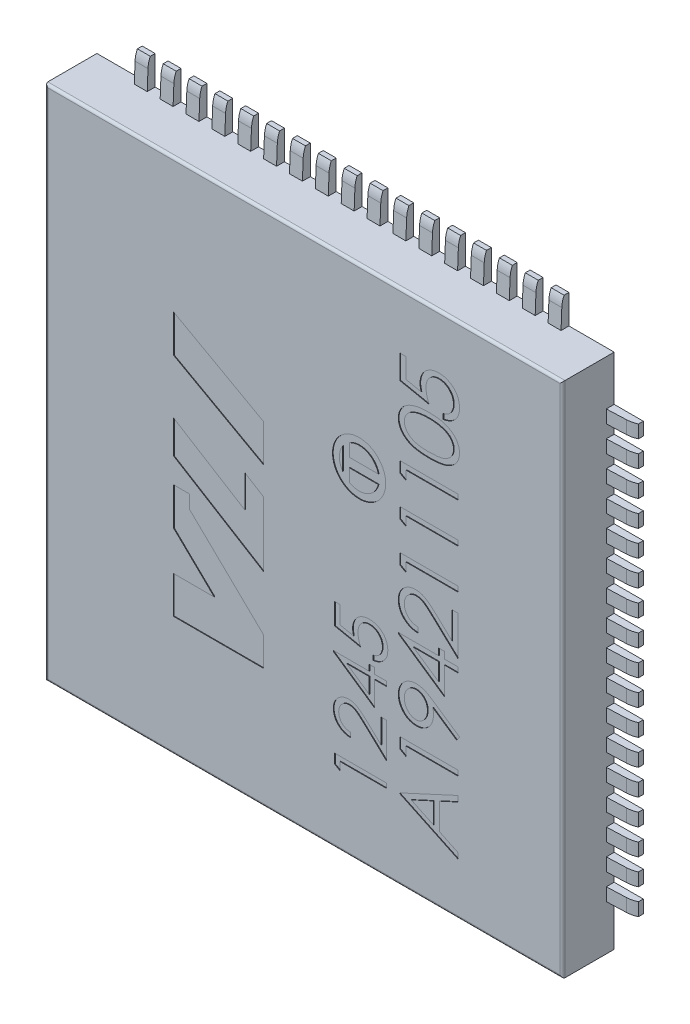
from build123d import *

# Parameters (mm, degrees)
SKETCH1_W                  = 8
SKETCH1_H                  = 8
BOSS_EXTRUDE1_DEPTH        = 0.8
FILLET1_R                  = 0.04
SKETCH3_W                  = 0.2
SKETCH3_H                  = 0.45
BOSS_EXTRUDE2_DEPTH        = 0.15
CUT_EXTRUDE2_DEPTH         = 9.586763069
LPATTERN1_COUNT            = 17
LPATTERN1_PITCH            = 0.4
SKETCH5_R                  = 2.5
BOSS_EXTRUDE3_DEPTH        = 0.1
CIRPATTERN1_COUNT          = 4
SZKIC1_R                   = 0.411647508
WYTNIJ_WYCI_GNI_CIE1_DEPTH = 0.01
WYTNIJ_WYCI_GNI_CIE2_DEPTH = 0.01


with BuildPart() as part:
    # Sketch1 → Boss-Extrude1 (new body)
    with BuildSketch(Plane.XY):
        Rectangle(SKETCH1_W, SKETCH1_H)
    extrude(amount=BOSS_EXTRUDE1_DEPTH)

    # Fillet1
    fillet1_edges = [part.edges().sort_by_distance(p)[0] for p in [
        (4, 0, 0.8),
        (0, 4, 0.8),
        (-4, 0, 0.8),
        (0, -4, 0.8),
    ]]
    fillet(fillet1_edges, radius=FILLET1_R)

    # Szkic1 → Wytnij-wyciągnięcie1 (cut)
    # profile 1 of 4: a face of its own
    with BuildSketch(Plane.XY.offset(0.8)):
        with Locations((0.855307319, 1.272637091)):
            Circle(SZKIC1_R)
        with BuildLine():
            Line((1.152633787, 1.201855815), (0.704434239, 1.201855815))
            Line((0.704434239, 1.201855815), (0.704434239, 1.006835791))
            ThreePointArc((0.704434239, 1.006835791), (0.977251368, 0.992382445), (1.152633787, 1.201855815))
        make_face(mode=Mode.SUBTRACT)
        with BuildLine():
            Line((1.152633787, 1.343418368), (0.704434239, 1.343418368))
            Line((0.704434239, 1.343418368), (0.704434239, 1.538438391))
            ThreePointArc((0.704434239, 1.538438391), (0.977251368, 1.552891737), (1.152633787, 1.343418368))
        make_face(mode=Mode.SUBTRACT)
        with BuildLine():
            Line((0.601420297, 1.102477174), (0.601420297, 1.442797008))
            ThreePointArc((0.601420297, 1.442797008), (0.549671887, 1.272637091), (0.601420297, 1.102477174))
        make_face(mode=Mode.SUBTRACT)
    # profile 2 of 4: a face of its own
    with BuildSketch(Plane.XY.offset(0.8)):
        Polygon((-2.01662611, -2.147052964), (-2.01662611, -1.573244018), (-1.38543627, -1.573244018), (-2.012111681, -0.967285149), (-2.012111681, -0.383894567), (-1.771453197, -0.383894567), (-1.771453197, -0.58733592), (-0.623213494, -1.697617287), (-0.623213494, -2.147052964), align=None)
    # profile 3 of 4: a face of its own
    with BuildSketch(Plane.XY.offset(0.8)):
        Polygon((-2.012111681, 0), (-2.012111681, 0.508995767), (-0.912436965, -0.170202966), (-0.912436965, 0.3284542), (-0.623213494, 0.149819362), (-0.623213494, -0.852189973), align=None)
    # profile 4 of 4: a face of its own
    with BuildSketch(Plane.XY.offset(0.8)):
        Polygon((-2.012111681, 1.348953622), (-2.012111681, 1.929165418), (-0.623213494, 1.158436315), (-0.623213494, 0.578224518), align=None)
    extrude(amount=-WYTNIJ_WYCI_GNI_CIE1_DEPTH, mode=Mode.SUBTRACT)

    # Szkic2 → Wytnij-wyciągnięcie2 (cut)
    # profile 1 of 14: a face of its own
    with BuildSketch(Plane.XY.offset(0.8)):
        Polygon((0.477972485, -2.880210932), (0.477972485, -2.732294265), (1.277972485, -2.732294265), (1.277972485, -2.804089137), (0.560023767, -2.804089137), (0.560023767, -2.92716606), align=None)
    # profile 2 of 14: a face of its own
    with BuildSketch(Plane.XY.offset(0.8)):
        with BuildLine():
            Line((0.724126331, -2.332294265), (0.724126331, -2.404089137))
            add(Edge.make_bspline(
                [(0.724126331, -2.404089137), (0.714601557, -2.403621216), (0.695895153, -2.402702232), (0.668621118, -2.398398623), (0.642551449, -2.392240709), (0.617895469, -2.38353409), (0.59443517, -2.372721227), (0.572263738, -2.359754364), (0.551465752, -2.344395769), (0.532234016, -2.326977087), (0.514591143, -2.308058541), (0.499355659, -2.287645755), (0.486483048, -2.266195463), (0.475721622, -2.243772743), (0.467643943, -2.220124614), (0.461650425, -2.195465675), (0.458044403, -2.169687587), (0.457656795, -2.152124153), (0.457459664, -2.143191701)],
                knots=[0, 0, 0, 0, 1.10065271, 2.161652631, 3.183658789, 4.190468796, 5.17591951, 6.163126047, 7.15150782, 8.156236427, 9.156009102, 10.134482811, 11.092018607, 12.041330605, 13.001268258, 13.972401359, 14.968799086, 16, 16, 16, 16], degree=3))
            add(Edge.make_bspline(
                [(0.457459664, -2.143191701), (0.457663359, -2.134418952), (0.458063613, -2.117180815), (0.461552566, -2.092032516), (0.466899077, -2.068035008), (0.474821763, -2.045460253), (0.484763001, -2.024076572), (0.497126234, -2.00414873), (0.511326474, -1.985194852), (0.528076353, -1.968145159), (0.545948516, -1.95248296), (0.565035836, -1.938983091), (0.584772713, -1.927356897), (0.60531332, -1.917841221), (0.626724548, -1.910627916), (0.648801119, -1.905283547), (0.671797813, -1.902228418), (0.687365474, -1.901762109), (0.695280177, -1.901525034)],
                knots=[0, 0, 0, 0, 1.111674182, 2.184400057, 3.212814286, 4.223731311, 5.211378316, 6.196328225, 7.191884489, 8.207283132, 9.220262353, 10.201199469, 11.166417575, 12.120932471, 13.06540007, 14.026332106, 14.996573967, 16, 16, 16, 16], degree=3))
            add(Edge.make_bspline(
                [(0.695280177, -1.901525034), (0.706422534, -1.901912072), (0.728511717, -1.902679355), (0.760972327, -1.909242552), (0.792421984, -1.919493522), (0.81773423, -1.931834682), (0.838128526, -1.944287974), (0.854928473, -1.955498974), (0.873012738, -1.968697944), (0.892454518, -1.983772116), (0.912999207, -2.00098109), (0.935065971, -2.019877779), (0.95824678, -2.040950195), (0.9740899, -2.055727025), (0.982299408, -2.063384009)],
                knots=[0, 0, 0, 0, 1.184416499, 2.348048165, 3.509039915, 4.696071444, 5.333504901, 6.05069495, 6.844171097, 7.714965912, 8.667477798, 9.695072654, 10.805644396, 12, 12, 12, 12], degree=3))
            Line((0.982299408, -2.063384009), (1.195921203, -2.263544265))
            Line((1.195921203, -2.263544265), (1.195921203, -1.891268624))
            Line((1.195921203, -1.891268624), (1.277972485, -1.891268624))
            Line((1.277972485, -1.891268624), (1.277972485, -2.434858368))
            Line((1.277972485, -2.434858368), (0.946882741, -2.124601957))
            add(Edge.make_bspline(
                [(0.946882741, -2.124601957), (0.938997414, -2.117048155), (0.923851314, -2.102538846), (0.901738638, -2.082017114), (0.881224457, -2.063585345), (0.862347531, -2.047124227), (0.844831745, -2.032990854), (0.829244384, -2.020448629), (0.814900509, -2.010399352), (0.798274083, -1.999492975), (0.777974125, -1.98892978), (0.753166425, -1.97985267), (0.727628767, -1.974317847), (0.710371159, -1.973653885), (0.701690434, -1.973319906)],
                knots=[0, 0, 0, 0, 1.329631726, 2.553950428, 3.673215718, 4.687767853, 5.603093632, 6.413772471, 7.123043292, 7.734684054, 8.834405432, 9.900288307, 10.943827018, 12, 12, 12, 12], degree=3))
            add(Edge.make_bspline(
                [(0.701690434, -1.973319906), (0.696231828, -1.973465219), (0.685473965, -1.973751602), (0.66970122, -1.976279075), (0.654486406, -1.98009862), (0.639782721, -1.985571821), (0.625738001, -1.992796219), (0.612335148, -2.001590135), (0.599377671, -2.011736435), (0.587228345, -2.023473868), (0.576101213, -2.036367929), (0.566244279, -2.049989472), (0.558006768, -2.064400925), (0.551253968, -2.079541524), (0.545956738, -2.09536906), (0.542286206, -2.111914144), (0.539981638, -2.129131062), (0.539669827, -2.14088729), (0.539510946, -2.146877598)],
                knots=[0, 0, 0, 0, 0.991446411, 1.95395049, 2.89581595, 3.838931463, 4.798493298, 5.75982156, 6.748411868, 7.785213223, 8.824556874, 9.840280684, 10.836137867, 11.835679398, 12.848801643, 13.863922112, 14.911575587, 16, 16, 16, 16], degree=3))
            add(Edge.make_bspline(
                [(0.539510946, -2.146877598), (0.539667933, -2.153135359), (0.53997623, -2.165424567), (0.542311422, -2.183429548), (0.545851574, -2.200724117), (0.551474109, -2.217050225), (0.558117413, -2.232761402), (0.566557015, -2.24752224), (0.57636402, -2.261577813), (0.587735642, -2.274696936), (0.600512482, -2.286678871), (0.614593441, -2.297354601), (0.629877148, -2.306621134), (0.646300876, -2.31471739), (0.664028143, -2.321289356), (0.682991994, -2.326312007), (0.703111222, -2.330286083), (0.717004948, -2.331613753), (0.724126331, -2.332294265)],
                knots=[0, 0, 0, 0, 1.030878251, 2.024474673, 2.987898669, 3.934362936, 4.864849709, 5.795128259, 6.730474222, 7.685293701, 8.650606017, 9.611896181, 10.591709709, 11.591680886, 12.625074257, 13.701333388, 14.821793024, 16, 16, 16, 16], degree=3))
        make_face()
    # profile 3 of 14: a face of its own
    with BuildSketch(Plane.XY.offset(0.8)):
        Polygon((0.457459664, -1.382775034), (0.457459664, -1.368191701), (1.011305818, -1.368191701), (1.011305818, -1.275884009), (1.0933571, -1.275884009), (1.0933571, -1.368191701), (1.277972485, -1.368191701), (1.277972485, -1.439986573), (1.0933571, -1.439986573), (1.0933571, -1.819473752), align=None)
        Polygon((1.011305818, -1.439986573), (0.663869921, -1.439986573), (1.011305818, -1.678448111), align=None, mode=Mode.SUBTRACT)
    # profile 4 of 14: a face of its own
    with BuildSketch(Plane.XY.offset(0.8)):
        with BuildLine():
            Line((0.477972485, -0.701525034), (0.560023767, -0.701525034))
            Line((0.560023767, -0.701525034), (0.560023767, -0.973640419))
            Line((0.560023767, -0.973640419), (0.770440434, -1.016749393))
            add(Edge.make_bspline(
                [(0.770440434, -1.016749393), (0.768102086, -1.008279479), (0.763571907, -0.99187036), (0.758542016, -0.967650963), (0.755509915, -0.94465846), (0.755095901, -0.929738375), (0.754895562, -0.922518624)],
                knots=[0, 0, 0, 0, 1.100273476, 2.13160584, 3.095893838, 4, 4, 4, 4], degree=3))
            add(Edge.make_bspline(
                [(0.754895562, -0.922518624), (0.755082533, -0.913583558), (0.755450165, -0.896014986), (0.759189859, -0.870350002), (0.764606502, -0.84572661), (0.772951866, -0.822508375), (0.783143044, -0.800327958), (0.795979054, -0.779566282), (0.810965065, -0.759931957), (0.828023895, -0.741560684), (0.84699318, -0.72497257), (0.8674733, -0.710558046), (0.889017344, -0.69797684), (0.912130262, -0.688164629), (0.936376135, -0.680156907), (0.962034843, -0.674876595), (0.988878594, -0.671349576), (1.007234137, -0.670956332), (1.01659428, -0.670755803)],
                knots=[0, 0, 0, 0, 1.052805225, 2.070078116, 3.052532748, 4.020689046, 4.973125432, 5.925915817, 6.89216474, 7.881560752, 8.877013184, 9.857446635, 10.830895175, 11.812622661, 12.812548702, 13.836681939, 14.896847428, 16, 16, 16, 16], degree=3))
            add(Edge.make_bspline(
                [(1.01659428, -0.670755803), (1.023113604, -0.670907958), (1.036064148, -0.67121021), (1.055297706, -0.672743879), (1.074121274, -0.675708083), (1.092500345, -0.679639538), (1.11045213, -0.684887837), (1.128077141, -0.691026677), (1.145182385, -0.698656848), (1.16184341, -0.707115744), (1.177869536, -0.716482379), (1.192876507, -0.727014951), (1.207206785, -0.7379589), (1.220434783, -0.749917184), (1.232611811, -0.762753846), (1.243798068, -0.776397459), (1.254194315, -0.790724275), (1.263375477, -0.805959939), (1.27182419, -0.821763887), (1.278755275, -0.838364635), (1.284951969, -0.85538422), (1.289891289, -0.873067621), (1.293761588, -0.891374778), (1.296390296, -0.91033587), (1.298304911, -0.929851451), (1.298424764, -0.943080026), (1.298485305, -0.949762214)],
                knots=[0, 0, 0, 0, 1.056393913, 2.098511576, 3.122979385, 4.141471433, 5.141222888, 6.151259816, 7.162667642, 8.172852865, 9.177685681, 10.166741883, 11.141342384, 12.097242845, 13.052202613, 14.005160326, 14.953864445, 15.917140761, 16.884916217, 17.854238259, 18.828761908, 19.81781811, 20.826036654, 21.857789401, 22.917898972, 24, 24, 24, 24], degree=3))
            add(Edge.make_bspline(
                [(1.298485305, -0.949762214), (1.298326975, -0.957733252), (1.298015478, -0.973415327), (1.294771592, -0.996394354), (1.290094877, -1.018489969), (1.283166069, -1.039607473), (1.274093289, -1.059658794), (1.263313453, -1.078931062), (1.250480224, -1.097185406), (1.235710983, -1.114297027), (1.219482698, -1.1300264), (1.202040471, -1.144289911), (1.183362088, -1.156830171), (1.163508286, -1.167692669), (1.14251428, -1.176946527), (1.120315383, -1.184219306), (1.097023776, -1.19008843), (1.080988712, -1.192571527), (1.07284428, -1.193832727)],
                knots=[0, 0, 0, 0, 1.046872515, 2.059598001, 3.044168548, 4.012104806, 4.973680974, 5.932408326, 6.910122221, 7.900780896, 8.89867654, 9.876692837, 10.858029398, 11.85084981, 12.847361615, 13.868568023, 14.917415949, 16, 16, 16, 16], degree=3))
            Line((1.07284428, -1.193832727), (1.07284428, -1.122037855))
            add(Edge.make_bspline(
                [(1.07284428, -1.122037855), (1.080473977, -1.120272432), (1.09513868, -1.116879193), (1.115729559, -1.109411743), (1.134085029, -1.100370151), (1.150317317, -1.089368108), (1.164723552, -1.076615332), (1.177425497, -1.061790889), (1.188898822, -1.045265385), (1.198478823, -1.02689227), (1.206548682, -1.007470998), (1.212307598, -0.987260005), (1.215793594, -0.966550164), (1.216219743, -0.952606708), (1.216434023, -0.945595547)],
                knots=[0, 0, 0, 0, 1.13623081, 2.183898708, 3.172478118, 4.09966615, 5.022692284, 5.957376522, 6.927682873, 7.937366477, 8.960015386, 9.976409503, 10.982481913, 12, 12, 12, 12], degree=3))
            add(Edge.make_bspline(
                [(1.216434023, -0.945595547), (1.216244847, -0.938748483), (1.215872358, -0.925266559), (1.21305167, -0.905415625), (1.208593378, -0.88630631), (1.202347566, -0.867904692), (1.194084723, -0.850301195), (1.183934296, -0.833520706), (1.17214953, -0.817324174), (1.158679973, -0.802137868), (1.143828083, -0.788232441), (1.127947973, -0.775945136), (1.111006865, -0.765710463), (1.093298746, -0.75708551), (1.074629354, -0.750536189), (1.05508623, -0.745863963), (1.034621091, -0.743120407), (1.020662392, -0.742742995), (1.013549408, -0.742550675)],
                knots=[0, 0, 0, 0, 1.027268864, 2.022700798, 3.002744649, 3.968653148, 4.933396556, 5.915045722, 6.907600446, 7.935526002, 8.956456544, 9.95700807, 10.942805781, 11.92166854, 12.907987664, 13.905483474, 14.932689774, 16, 16, 16, 16], degree=3))
            add(Edge.make_bspline(
                [(1.013549408, -0.742550675), (1.007131335, -0.742696612), (0.994621846, -0.742981057), (0.976255983, -0.745443481), (0.958850547, -0.749556921), (0.942329804, -0.755413624), (0.926746576, -0.762722977), (0.912135202, -0.771900091), (0.898358298, -0.782554197), (0.885770402, -0.794992624), (0.874134065, -0.808523058), (0.864250363, -0.82349303), (0.85584508, -0.839502896), (0.848958436, -0.856582326), (0.843472696, -0.874752357), (0.839681427, -0.894022776), (0.837412789, -0.914397974), (0.837105036, -0.928335264), (0.836946844, -0.935499393)],
                knots=[0, 0, 0, 0, 1.045723156, 2.038222538, 3.013889863, 3.95567481, 4.890389958, 5.81331128, 6.76251276, 7.723027653, 8.692928204, 9.666105983, 10.639751036, 11.635719707, 12.66315958, 13.728667616, 14.832476222, 16, 16, 16, 16], degree=3))
            add(Edge.make_bspline(
                [(0.836946844, -0.935499393), (0.83707955, -0.941700291), (0.837353556, -0.954503572), (0.839371041, -0.974143076), (0.842625737, -0.994781184), (0.847102593, -1.016338783), (0.852961125, -1.038880613), (0.859981582, -1.062359105), (0.868375182, -1.086823623), (0.874713974, -1.103307674), (0.877972485, -1.111781444)],
                knots=[0, 0, 0, 0, 0.817624296, 1.688186739, 2.600797293, 3.572016777, 4.590301741, 5.671205678, 6.80286297, 8, 8, 8, 8], degree=3))
            Line((0.877972485, -1.111781444), (0.477972485, -1.029730162))
            Line((0.477972485, -1.029730162), (0.477972485, -0.701525034))
        make_face()
    # profile 5 of 14: a face of its own
    with BuildSketch(Plane.XY.offset(0.8)):
        Polygon((1.48522985, -2.761153846), (2.38522985, -2.345769231), (2.38522985, -2.433569712), (2.096768311, -2.566622596), (2.096768311, -2.974615385), (2.38522985, -3.111454327), (2.38522985, -3.199615385), (1.48522985, -2.772692308), align=None)
        Polygon((1.660650523, -2.767824519), (2.004460619, -2.930805288), (2.004460619, -2.609170673), align=None, mode=Mode.SUBTRACT)
    # profile 6 of 14: a face of its own
    with BuildSketch(Plane.XY.offset(0.8)):
        Polygon((1.48522985, -2.172944712), (1.48522985, -2.006538462), (2.38522985, -2.006538462), (2.38522985, -2.087307692), (1.577537542, -2.087307692), (1.577537542, -2.225769231), align=None)
    # profile 7 of 14: a face of its own
    with BuildSketch(Plane.XY.offset(0.8)):
        with BuildLine():
            Line((2.408306773, -1.551923077), (2.363414946, -1.616466346))
            Line((2.363414946, -1.616466346), (1.997609658, -1.366225962))
            add(Edge.make_bspline(
                [(1.997609658, -1.366225962), (1.999653267, -1.382189943), (2.003676179, -1.413615567), (2.00420194, -1.445292243), (2.004460619, -1.460877404)],
                knots=[0, 0, 0, 0, 1.015985029, 2, 2, 2, 2], degree=3))
            add(Edge.make_bspline(
                [(2.004460619, -1.460877404), (2.004218628, -1.470325359), (2.003743621, -1.488870869), (1.999978584, -1.516136151), (1.99417998, -1.542335294), (1.985527444, -1.567398847), (1.974774184, -1.591420991), (1.961439548, -1.614349371), (1.94575212, -1.636152794), (1.927795431, -1.656598342), (1.908076862, -1.675189876), (1.887213156, -1.691766374), (1.864979089, -1.705467703), (1.841843584, -1.717052596), (1.817312836, -1.725592023), (1.791803088, -1.731960741), (1.76515599, -1.735838748), (1.747021521, -1.73630283), (1.737813985, -1.736538462)],
                knots=[0, 0, 0, 0, 1.060698949, 2.082059282, 3.085738422, 4.069684654, 5.054463875, 6.037298355, 7.043153692, 8.066652628, 9.088369706, 10.083456696, 11.053578809, 12.016466116, 12.983507685, 13.964045196, 14.966270913, 16, 16, 16, 16], degree=3))
            add(Edge.make_bspline(
                [(1.737813985, -1.736538462), (1.725222531, -1.736091568), (1.700508061, -1.735214406), (1.664389612, -1.728181829), (1.630219171, -1.716530148), (1.59803495, -1.700538821), (1.568576219, -1.680011053), (1.541942786, -1.655632807), (1.518609754, -1.627207051), (1.498575599, -1.595475936), (1.482353165, -1.561230454), (1.470827816, -1.525216027), (1.463465155, -1.488039341), (1.462592222, -1.462774441), (1.462152927, -1.450060096)],
                knots=[0, 0, 0, 0, 1.023011052, 2.007963168, 2.978169221, 3.950402619, 4.919353283, 5.887490769, 6.876420893, 7.899700203, 8.931203047, 9.947778163, 10.96723692, 12, 12, 12, 12], degree=3))
            add(Edge.make_bspline(
                [(1.462152927, -1.450060096), (1.462623543, -1.43759165), (1.463553435, -1.412955174), (1.470363562, -1.376726513), (1.481841703, -1.342027619), (1.497702922, -1.30904949), (1.517587395, -1.27851964), (1.541271977, -1.251051506), (1.568776447, -1.227373992), (1.599345262, -1.207187064), (1.632392084, -1.19128443), (1.666821382, -1.179631836), (1.702426062, -1.172509022), (1.726543812, -1.171608378), (1.738715427, -1.171153846)],
                knots=[0, 0, 0, 0, 1.026358223, 2.027987109, 3.023239252, 4.028077889, 5.032770297, 6.015020143, 7.004250571, 8.011656937, 9.02310243, 10.015224881, 10.998334443, 12, 12, 12, 12], degree=3))
            add(Edge.make_bspline(
                [(1.738715427, -1.171153846), (1.748163477, -1.171458215), (1.767326483, -1.172075552), (1.796390435, -1.176349328), (1.826000685, -1.183721308), (1.851087317, -1.191958476), (1.871870241, -1.200032287), (1.888335432, -1.207412942), (1.905545369, -1.215986591), (1.923570526, -1.225561791), (1.94243442, -1.236120401), (1.962006216, -1.247949452), (1.982314449, -1.260889394), (1.996006867, -1.270102155), (2.003018311, -1.274819712)],
                knots=[0, 0, 0, 0, 1.179894106, 2.393120058, 3.660107319, 4.986885617, 5.687958251, 6.443931318, 7.239444731, 8.088894906, 8.992865148, 9.938946712, 10.944601238, 12, 12, 12, 12], degree=3))
            Line((2.003018311, -1.274819712), (2.408306773, -1.551923077))
        make_face()
        with BuildLine():
            add(Edge.make_bspline(
                [(1.912152927, -1.445913462), (1.911956995, -1.438756315), (1.911575581, -1.424823785), (1.909264537, -1.404410096), (1.905136713, -1.385152455), (1.899307648, -1.366926917), (1.891923387, -1.349755547), (1.882924457, -1.333632936), (1.872113709, -1.31872377), (1.859962212, -1.304974969), (1.846644654, -1.292497514), (1.832376128, -1.281739072), (1.817599907, -1.272424208), (1.8020135, -1.264993029), (1.785871883, -1.259004259), (1.768941617, -1.254825505), (1.751339596, -1.252517522), (1.739382936, -1.252123375), (1.733306773, -1.251923077)],
                knots=[0, 0, 0, 0, 1.163726718, 2.265380301, 3.334713825, 4.36057981, 5.371541381, 6.368955992, 7.355979581, 8.359691305, 9.348261197, 10.317521986, 11.261029684, 12.183096459, 13.119698615, 14.055740009, 15.011961376, 16, 16, 16, 16], degree=3))
            add(Edge.make_bspline(
                [(1.733306773, -1.251923077), (1.727227919, -1.252095111), (1.715248791, -1.252434124), (1.697622911, -1.255158971), (1.680725907, -1.259939387), (1.664442749, -1.266418462), (1.648862454, -1.274791686), (1.633935915, -1.284936998), (1.619889068, -1.297187677), (1.606490411, -1.310877264), (1.594335562, -1.325934173), (1.583596447, -1.341887062), (1.574533221, -1.358650707), (1.56737637, -1.376299891), (1.561513226, -1.394594944), (1.557362654, -1.413725262), (1.555050282, -1.433717286), (1.554659677, -1.447289924), (1.554460619, -1.454206731)],
                knots=[0, 0, 0, 0, 0.971910406, 1.91526867, 2.84337505, 3.775008003, 4.712374136, 5.666733183, 6.654995996, 7.688089235, 8.726800303, 9.745078658, 10.75990398, 11.768337501, 12.786615857, 13.829099629, 14.893678693, 16, 16, 16, 16], degree=3))
            add(Edge.make_bspline(
                [(1.554460619, -1.454206731), (1.554660004, -1.461063382), (1.555051195, -1.474516075), (1.557358211, -1.494330379), (1.561541422, -1.513331315), (1.567373713, -1.531573262), (1.574533769, -1.549221935), (1.583596925, -1.565984789), (1.594333069, -1.581941394), (1.606500089, -1.596983979), (1.619826589, -1.610698241), (1.633998681, -1.62274162), (1.648854552, -1.632909874), (1.664444837, -1.641271402), (1.680725352, -1.647753571), (1.697623061, -1.65253316), (1.715248752, -1.655258229), (1.727227906, -1.655597212), (1.733306773, -1.655769231)],
                knots=[0, 0, 0, 0, 1.099107991, 2.156440826, 3.191784126, 4.212280276, 5.222910149, 6.239945746, 7.260441896, 8.30141526, 9.33675856, 10.320924759, 11.277362386, 12.216770088, 13.150432123, 14.080559904, 15.025972789, 16, 16, 16, 16], degree=3))
            add(Edge.make_bspline(
                [(1.733306773, -1.655769231), (1.73938765, -1.655613252), (1.751380252, -1.655305633), (1.769002598, -1.652343782), (1.785889101, -1.64737742), (1.802183911, -1.640791997), (1.817676215, -1.631954169), (1.832446348, -1.621213653), (1.846796265, -1.608820931), (1.859920572, -1.594369865), (1.872171869, -1.57885192), (1.882856484, -1.562183994), (1.891815861, -1.544701038), (1.899329415, -1.526515304), (1.905077914, -1.507490715), (1.90925687, -1.487653763), (1.911553425, -1.467000873), (1.911951176, -1.453010037), (1.912152927, -1.445913462)],
                knots=[0, 0, 0, 0, 0.952872936, 1.879239831, 2.791748947, 3.708674669, 4.628500839, 5.580394867, 6.568761142, 7.595635223, 8.636123962, 9.665976811, 10.694276597, 11.712685318, 12.747011694, 13.805940053, 14.887106426, 16, 16, 16, 16], degree=3))
        make_face(mode=Mode.SUBTRACT)
    # profile 8 of 14: a face of its own
    with BuildSketch(Plane.XY.offset(0.8)):
        Polygon((1.462152927, -0.640637019), (1.462152927, -0.624230769), (2.08522985, -0.624230769), (2.08522985, -0.520384615), (2.177537542, -0.520384615), (2.177537542, -0.624230769), (2.38522985, -0.624230769), (2.38522985, -0.705), (2.177537542, -0.705), (2.177537542, -1.131923077), align=None)
        Polygon((2.08522985, -0.705), (1.694364465, -0.705), (2.08522985, -0.973269231), align=None, mode=Mode.SUBTRACT)
    # profile 9 of 14: a face of its own
    with BuildSketch(Plane.XY.offset(0.8)):
        with BuildLine():
            Line((1.762152927, -0.400384615), (1.762152927, -0.481153846))
            add(Edge.make_bspline(
                [(1.762152927, -0.481153846), (1.751437556, -0.480627435), (1.730392852, -0.479593579), (1.699709562, -0.474752019), (1.670381185, -0.467824364), (1.642643207, -0.458029419), (1.616250371, -0.445864948), (1.59130751, -0.431277226), (1.567909775, -0.413998808), (1.546274073, -0.39440279), (1.52642584, -0.373119426), (1.509285921, -0.350155042), (1.494804234, -0.326023463), (1.482697629, -0.300797903), (1.47361024, -0.274193758), (1.466867533, -0.246452452), (1.462810758, -0.217452103), (1.462374699, -0.19769324), (1.462152927, -0.187644231)],
                knots=[0, 0, 0, 0, 1.10065271, 2.161652631, 3.183658789, 4.190468796, 5.17591951, 6.163126047, 7.15150782, 8.156236427, 9.156009102, 10.134482811, 11.092018607, 12.041330605, 13.001268258, 13.972401359, 14.968799086, 16, 16, 16, 16], degree=3))
            add(Edge.make_bspline(
                [(1.462152927, -0.187644231), (1.462382084, -0.177774889), (1.462832369, -0.158381984), (1.466757442, -0.130090148), (1.472772266, -0.103092951), (1.481685288, -0.077696352), (1.492869181, -0.053639711), (1.506777818, -0.031220889), (1.522753087, -0.009897775), (1.541596701, 0.009283129), (1.561702885, 0.026903103), (1.58317612, 0.042090456), (1.605380107, 0.055169923), (1.62848829, 0.065875059), (1.652575921, 0.073990028), (1.677412064, 0.080002442), (1.703283344, 0.083439463), (1.720796963, 0.08396406), (1.729701004, 0.084230769)],
                knots=[0, 0, 0, 0, 1.111674182, 2.184400057, 3.212814286, 4.223731311, 5.211378316, 6.196328225, 7.191884489, 8.207283132, 9.220262353, 10.201199469, 11.166417575, 12.120932471, 13.06540007, 14.026332106, 14.996573967, 16, 16, 16, 16], degree=3))
            add(Edge.make_bspline(
                [(1.729701004, 0.084230769), (1.742236156, 0.083795352), (1.767086486, 0.082932158), (1.803604672, 0.075548562), (1.838985536, 0.06401622), (1.867461813, 0.050132416), (1.890405396, 0.036122462), (1.909305336, 0.023510087), (1.929650135, 0.008661246), (1.951522138, -0.008297198), (1.974634912, -0.027657294), (1.999460022, -0.048916068), (2.025538432, -0.072622537), (2.043361942, -0.089246471), (2.052597638, -0.097860577)],
                knots=[0, 0, 0, 0, 1.184416499, 2.348048165, 3.509039915, 4.696071444, 5.333504901, 6.05069495, 6.844171097, 7.714965912, 8.667477798, 9.695072654, 10.805644396, 12, 12, 12, 12], degree=3))
            Line((2.052597638, -0.097860577), (2.292922158, -0.323040865))
            Line((2.292922158, -0.323040865), (2.292922158, 0.095769231))
            Line((2.292922158, 0.095769231), (2.38522985, 0.095769231))
            Line((2.38522985, 0.095769231), (2.38522985, -0.515769231))
            Line((2.38522985, -0.515769231), (2.012753888, -0.166730769))
            add(Edge.make_bspline(
                [(2.012753888, -0.166730769), (2.003882895, -0.158232741), (1.986843533, -0.141909769), (1.961966772, -0.11882282), (1.938888319, -0.09808708), (1.917651777, -0.079568322), (1.897946517, -0.063668278), (1.880410736, -0.049558275), (1.864273878, -0.038252838), (1.845569148, -0.025983165), (1.822731695, -0.014099569), (1.794823032, -0.003887821), (1.766093167, 0.002338855), (1.746678358, 0.003085812), (1.736912542, 0.003461538)],
                knots=[0, 0, 0, 0, 1.329631726, 2.553950428, 3.673215718, 4.687767853, 5.603093632, 6.413772471, 7.123043292, 7.734684054, 8.834405432, 9.900288307, 10.943827018, 12, 12, 12, 12], degree=3))
            add(Edge.make_bspline(
                [(1.736912542, 0.003461538), (1.730771611, 0.003298062), (1.718669015, 0.002975881), (1.700924677, 0.000132473), (1.683808011, -0.004164514), (1.667266366, -0.010321866), (1.651466056, -0.018449314), (1.636387846, -0.028342469), (1.621810684, -0.039757056), (1.608142693, -0.052961669), (1.595624669, -0.067467488), (1.584535618, -0.082791723), (1.575268418, -0.099004607), (1.567671519, -0.116037782), (1.561712135, -0.13384376), (1.557582786, -0.15245698), (1.554990147, -0.171826013), (1.55463936, -0.185051769), (1.554460619, -0.191790865)],
                knots=[0, 0, 0, 0, 0.991446411, 1.95395049, 2.89581595, 3.838931463, 4.798493298, 5.75982156, 6.748411868, 7.785213223, 8.824556874, 9.840280684, 10.836137867, 11.835679398, 12.848801643, 13.863922112, 14.911575587, 16, 16, 16, 16], degree=3))
            add(Edge.make_bspline(
                [(1.554460619, -0.191790865), (1.55463723, -0.198830846), (1.554984063, -0.212656206), (1.557611154, -0.232911809), (1.561593826, -0.252368199), (1.567919177, -0.27073507), (1.575392894, -0.288410144), (1.584887446, -0.305016087), (1.595920327, -0.320828607), (1.608713402, -0.33558762), (1.623087346, -0.349067297), (1.638928425, -0.361077494), (1.656122596, -0.371502343), (1.67459929, -0.38061063), (1.694542466, -0.388004093), (1.715876798, -0.393654575), (1.738510929, -0.39812541), (1.754141371, -0.399619039), (1.762152927, -0.400384615)],
                knots=[0, 0, 0, 0, 1.030878251, 2.024474673, 2.987898669, 3.934362936, 4.864849709, 5.795128259, 6.730474222, 7.685293701, 8.650606017, 9.611896181, 10.591709709, 11.591680886, 12.625074257, 13.701333388, 14.821793024, 16, 16, 16, 16], degree=3))
        make_face()
    # profile 10 of 14: a face of its own
    with BuildSketch(Plane.XY.offset(0.8)):
        Polygon((1.48522985, 0.291670673), (1.48522985, 0.458076923), (2.38522985, 0.458076923), (2.38522985, 0.377307692), (1.577537542, 0.377307692), (1.577537542, 0.238846154), align=None)
    # profile 11 of 14: a face of its own
    with BuildSketch(Plane.XY.offset(0.8)):
        Polygon((1.48522985, 0.907824519), (1.48522985, 1.074230769), (2.38522985, 1.074230769), (2.38522985, 0.993461538), (1.577537542, 0.993461538), (1.577537542, 0.855), align=None)
    # profile 12 of 14: a face of its own
    with BuildSketch(Plane.XY.offset(0.8)):
        Polygon((1.48522985, 1.523978365), (1.48522985, 1.690384615), (2.38522985, 1.690384615), (2.38522985, 1.609615385), (1.577537542, 1.609615385), (1.577537542, 1.471153846), align=None)
    # profile 13 of 14: a face of its own
    with BuildSketch(Plane.XY.offset(0.8)):
        with BuildLine():
            add(Edge.make_bspline(
                [(1.935590427, 1.948846154), (1.921165384, 1.948930501), (1.893144531, 1.949094348), (1.852314195, 1.950917084), (1.81401012, 1.95394503), (1.778230475, 1.95809464), (1.744966021, 1.963144406), (1.714305657, 1.969885533), (1.686107465, 1.977551675), (1.660279533, 1.986436612), (1.636473757, 1.996461968), (1.61425042, 2.007373902), (1.593641478, 2.019603902), (1.574323966, 2.032458493), (1.556592916, 2.046438101), (1.540244034, 2.061242977), (1.525415191, 2.077169222), (1.512096234, 2.094062364), (1.500417453, 2.111807911), (1.490067029, 2.129920944), (1.48154144, 2.148725102), (1.474567274, 2.16797284), (1.468874101, 2.187704723), (1.464963475, 2.207915716), (1.46250729, 2.228652667), (1.462272169, 2.24264924), (1.462152927, 2.249747596)],
                knots=[0, 0, 0, 0, 1.646148282, 3.197666765, 4.66315463, 6.030252048, 7.307778049, 8.501004361, 9.610818041, 10.641065266, 11.615491391, 12.557119604, 13.464013759, 14.348536654, 15.203310953, 16.038349431, 16.863300206, 17.683791446, 18.490318933, 19.285717724, 20.06220424, 20.843281102, 21.620494212, 22.403315558, 23.190242141, 24, 24, 24, 24], degree=3))
            add(Edge.make_bspline(
                [(1.462152927, 2.249747596), (1.462252248, 2.256908762), (1.462449863, 2.271156961), (1.465231408, 2.292146285), (1.468821628, 2.312770011), (1.47457975, 2.332715235), (1.481470091, 2.352359085), (1.490561785, 2.371213057), (1.500449708, 2.389942795), (1.512512143, 2.407697433), (1.525843119, 2.425007448), (1.540977185, 2.441233779), (1.557495503, 2.456791215), (1.575766481, 2.471092158), (1.595509971, 2.484749526), (1.616891479, 2.497244873), (1.639863622, 2.508838078), (1.664319903, 2.519747063), (1.690913589, 2.529286682), (1.719478807, 2.537768166), (1.750274229, 2.544720177), (1.783128305, 2.550469368), (1.818203794, 2.554931835), (1.855429628, 2.558179543), (1.894829097, 2.559895674), (1.921766838, 2.560218798), (1.935590427, 2.560384615)],
                knots=[0, 0, 0, 0, 0.810910589, 1.61342667, 2.396193133, 3.181089899, 3.963115317, 4.752255436, 5.550715454, 6.36105385, 7.181178335, 8.024612154, 8.872680183, 9.750181803, 10.651284446, 11.591556747, 12.554036451, 13.566402641, 14.62422919, 15.753422176, 16.94128843, 18.199818041, 19.531985927, 20.947085226, 22.433341622, 24, 24, 24, 24], degree=3))
            add(Edge.make_bspline(
                [(1.935590427, 2.560384615), (1.949353597, 2.56021515), (1.976230601, 2.559884215), (2.01545464, 2.558216349), (2.052479819, 2.554852509), (2.087345613, 2.550706152), (2.120068187, 2.544892703), (2.150626219, 2.537887977), (2.179127899, 2.529907134), (2.205369015, 2.520221107), (2.229782857, 2.509566038), (2.252586087, 2.497985273), (2.273961949, 2.48556044), (2.293757515, 2.4721079), (2.311955156, 2.457571721), (2.32853013, 2.442025189), (2.343760454, 2.425657183), (2.357238298, 2.408246255), (2.36939257, 2.390326243), (2.379639321, 2.371594602), (2.388517529, 2.352530724), (2.395776283, 2.332944276), (2.401405532, 2.312865496), (2.405275334, 2.292227635), (2.407995507, 2.271153999), (2.408202659, 2.256907771), (2.408306773, 2.249747596)],
                knots=[0, 0, 0, 0, 1.561645053, 3.049612875, 4.452756685, 5.778837748, 7.032101753, 8.221335837, 9.334924186, 10.387562255, 11.392109817, 12.355697819, 13.287721948, 14.19548756, 15.068665045, 15.927346723, 16.771751757, 17.602390507, 18.423119567, 19.225778204, 20.022010933, 20.807278863, 21.593079439, 22.384715467, 23.188155646, 24, 24, 24, 24], degree=3))
            add(Edge.make_bspline(
                [(2.408306773, 2.249747596), (2.408186853, 2.242649395), (2.407950394, 2.228653129), (2.405504006, 2.207913934), (2.401570877, 2.187784163), (2.39606375, 2.168164483), (2.38932279, 2.148954239), (2.380540422, 2.130415182), (2.370425918, 2.11234125), (2.358907208, 2.094780397), (2.345709773, 2.078063622), (2.331114882, 2.062092981), (2.314748272, 2.047284454), (2.296867618, 2.033426061), (2.277521364, 2.020435575), (2.256696529, 2.008311257), (2.234357552, 1.997170492), (2.210363637, 1.986973855), (2.18435239, 1.977933398), (2.156082319, 1.969978679), (2.125266283, 1.963625489), (2.092060742, 1.958240179), (2.056398225, 1.953924859), (2.018265829, 1.950918342), (1.977735965, 1.949095731), (1.949895301, 1.948930864), (1.935590427, 1.948846154)],
                knots=[0, 0, 0, 0, 0.810927267, 1.598990287, 2.382942141, 3.152806972, 3.926217614, 4.706701772, 5.493896336, 6.292070767, 7.104102563, 7.925577746, 8.761822141, 9.623241997, 10.509042271, 11.423174113, 12.375371989, 13.360203808, 14.400680605, 15.520553799, 16.714061498, 17.994519714, 19.364400916, 20.818312473, 22.365209998, 24, 24, 24, 24], degree=3))
        make_face()
        with BuildLine():
            add(Edge.make_bspline(
                [(1.93522985, 2.029615385), (1.947250896, 2.029646773), (1.970581386, 2.029707692), (2.004424683, 2.031253097), (2.036043363, 2.033404143), (2.065425085, 2.036110282), (2.09246716, 2.040163111), (2.117282013, 2.044761293), (2.139823711, 2.050276531), (2.160289243, 2.056834225), (2.178968408, 2.064304077), (2.196359072, 2.072445522), (2.212667347, 2.081269252), (2.227853667, 2.090956133), (2.241732396, 2.101697681), (2.254655328, 2.112995918), (2.266173014, 2.125359823), (2.279988982, 2.142460025), (2.294265099, 2.16503662), (2.306697021, 2.193481772), (2.314509635, 2.222710829), (2.315503174, 2.242549718), (2.315999081, 2.252451923)],
                knots=[0, 0, 0, 0, 1.459098681, 2.831824031, 4.11146945, 5.306290378, 6.412266529, 7.42953815, 8.369053297, 9.227277979, 10.03601793, 10.809473603, 11.557037441, 12.285528272, 12.993193355, 13.685654407, 14.36688038, 15.041354379, 16.352855396, 17.594313975, 18.799247529, 20, 20, 20, 20], degree=3))
            add(Edge.make_bspline(
                [(2.315999081, 2.252451923), (2.315564855, 2.262411448), (2.314697945, 2.282295169), (2.307131894, 2.311497376), (2.294831897, 2.339612473), (2.280779442, 2.361800609), (2.267311149, 2.378634106), (2.255841374, 2.390699479), (2.242994867, 2.401772298), (2.229135246, 2.412274623), (2.213996553, 2.421906935), (2.197651906, 2.430666034), (2.180055827, 2.438658893), (2.167772181, 2.443212648), (2.161491869, 2.445540865)],
                knots=[0, 0, 0, 0, 1.353621445, 2.702441307, 4.075953605, 5.516772412, 6.261413105, 7.007624062, 7.778524365, 8.566925914, 9.372323995, 10.217594641, 11.088702136, 12, 12, 12, 12], degree=3))
            add(Edge.make_bspline(
                [(2.161491869, 2.445540865), (2.153461365, 2.448254177), (2.137155997, 2.453763364), (2.111862486, 2.460863534), (2.085324633, 2.466455208), (2.057701031, 2.471485788), (2.028787965, 2.474919431), (1.998674895, 2.477683154), (1.967339116, 2.479311045), (1.946048976, 2.479512838), (1.93522985, 2.479615385)],
                knots=[0, 0, 0, 0, 0.884706709, 1.796334032, 2.740027952, 3.714592787, 4.726048262, 5.777819803, 6.87074269, 8, 8, 8, 8], degree=3))
            add(Edge.make_bspline(
                [(1.93522985, 2.479615385), (1.924412474, 2.479473907), (1.903251375, 2.479197148), (1.872260985, 2.478139265), (1.842826418, 2.475407489), (1.814820868, 2.47237343), (1.788399361, 2.467899859), (1.763340713, 2.463076421), (1.739955357, 2.456596116), (1.717877204, 2.449673864), (1.697356948, 2.441751276), (1.67829942, 2.433029793), (1.66061086, 2.423716656), (1.644345921, 2.413596481), (1.629410258, 2.402810234), (1.61614754, 2.390971178), (1.60391261, 2.378831183), (1.590196349, 2.36156555), (1.576100628, 2.339145601), (1.563481756, 2.311055172), (1.556013568, 2.281982788), (1.554977895, 2.262288447), (1.554460619, 2.252451923)],
                knots=[0, 0, 0, 0, 1.313483664, 2.569454835, 3.763100662, 4.901599063, 5.988328865, 7.015709358, 7.99797933, 8.932480776, 9.824041341, 10.666387587, 11.475829342, 12.24921787, 12.990555181, 13.709176526, 14.405678811, 15.080244297, 16.38186033, 17.610124501, 18.806354173, 20, 20, 20, 20], degree=3))
            add(Edge.make_bspline(
                [(1.554460619, 2.252451923), (1.554979182, 2.242496259), (1.556017254, 2.222566793), (1.563447218, 2.193183944), (1.576063707, 2.164903747), (1.590169192, 2.142409865), (1.60386002, 2.125353981), (1.615512491, 2.113250726), (1.628126765, 2.101795798), (1.642128614, 2.0913324), (1.657261425, 2.08170296), (1.673358806, 2.072538224), (1.690781964, 2.064505651), (1.709446482, 2.057011818), (1.729913139, 2.050443186), (1.752536401, 2.044990965), (1.777410513, 2.040027363), (1.804650174, 2.03645276), (1.834038166, 2.033305085), (1.865737706, 2.031276711), (1.899697218, 2.029700612), (1.923148416, 2.029644363), (1.93522985, 2.029615385)],
                knots=[0, 0, 0, 0, 1.207546505, 2.417292871, 3.651582144, 4.952510111, 5.626719005, 6.30238548, 6.989136872, 7.692112372, 8.420316868, 9.164734959, 9.937886623, 10.746308695, 11.604196049, 12.543341915, 13.568754172, 14.680483261, 15.875568977, 17.154711427, 18.534182925, 20, 20, 20, 20], degree=3))
        make_face(mode=Mode.SUBTRACT)
    # profile 14 of 14: a face of its own
    with BuildSketch(Plane.XY.offset(0.8)):
        with BuildLine():
            Line((1.48522985, 3.130384615), (1.577537542, 3.130384615))
            Line((1.577537542, 3.130384615), (1.577537542, 2.824254808))
            Line((1.577537542, 2.824254808), (1.814256292, 2.775757212))
            add(Edge.make_bspline(
                [(1.814256292, 2.775757212), (1.811625651, 2.785285865), (1.806529199, 2.803746124), (1.800870573, 2.830992945), (1.797459459, 2.856859512), (1.796993693, 2.873644607), (1.796768311, 2.881766827)],
                knots=[0, 0, 0, 0, 1.100273476, 2.13160584, 3.095893838, 4, 4, 4, 4], degree=3))
            add(Edge.make_bspline(
                [(1.796768311, 2.881766827), (1.796978654, 2.891818776), (1.79739224, 2.91158342), (1.801599396, 2.940456527), (1.80769312, 2.968157842), (1.817081654, 2.994278357), (1.828546729, 3.019231326), (1.842987241, 3.042588211), (1.859846503, 3.064676827), (1.879037687, 3.08534451), (1.900378132, 3.104006138), (1.923418267, 3.120222478), (1.947655317, 3.134376334), (1.973657349, 3.145415072), (2.000933956, 3.154423759), (2.029800003, 3.160364109), (2.059999223, 3.164332006), (2.080649209, 3.164774405), (2.091179369, 3.165)],
                knots=[0, 0, 0, 0, 1.052805225, 2.070078116, 3.052532748, 4.020689046, 4.973125432, 5.925915817, 6.89216474, 7.881560752, 8.877013184, 9.857446635, 10.830895175, 11.812622661, 12.812548702, 13.836681939, 14.896847428, 16, 16, 16, 16], degree=3))
            add(Edge.make_bspline(
                [(2.091179369, 3.165), (2.098513609, 3.164828827), (2.113082971, 3.164488793), (2.134720724, 3.162763415), (2.155897238, 3.159428685), (2.176573692, 3.155005798), (2.19676945, 3.149101462), (2.216597588, 3.142195268), (2.235840988, 3.133611325), (2.254584641, 3.124095066), (2.272614032, 3.113557603), (2.289496874, 3.101708459), (2.305618438, 3.089396517), (2.320499936, 3.075943446), (2.334199092, 3.061502202), (2.346783631, 3.046153137), (2.358479409, 3.030035469), (2.368808216, 3.012895347), (2.378313019, 2.995115907), (2.386110488, 2.976440065), (2.39308177, 2.957293031), (2.398638505, 2.937399205), (2.402992591, 2.916803653), (2.405949888, 2.895472425), (2.408103829, 2.873517396), (2.408238664, 2.85863525), (2.408306773, 2.851117788)],
                knots=[0, 0, 0, 0, 1.056393913, 2.098511576, 3.122979385, 4.141471433, 5.141222888, 6.151259816, 7.162667642, 8.172852865, 9.177685681, 10.166741883, 11.141342384, 12.097242845, 13.052202613, 14.005160326, 14.953864445, 15.917140761, 16.884916217, 17.854238259, 18.828761908, 19.81781811, 20.826036654, 21.857789401, 22.917898972, 24, 24, 24, 24], degree=3))
            add(Edge.make_bspline(
                [(2.408306773, 2.851117788), (2.408128651, 2.842150371), (2.407778218, 2.824508036), (2.404128846, 2.79865663), (2.398867541, 2.773799064), (2.391072632, 2.750041872), (2.380865754, 2.727484136), (2.368738439, 2.705802834), (2.354301057, 2.685266697), (2.33768566, 2.666016123), (2.31942884, 2.648320579), (2.299806334, 2.632274129), (2.278793153, 2.618166337), (2.256457626, 2.605946026), (2.232839369, 2.595535436), (2.20786561, 2.58735356), (2.181662553, 2.580750795), (2.163623106, 2.577957311), (2.154460619, 2.576538462)],
                knots=[0, 0, 0, 0, 1.046872515, 2.059598001, 3.044168548, 4.012104806, 4.973680974, 5.932408326, 6.910122221, 7.900780896, 8.89867654, 9.876692837, 10.858029398, 11.85084981, 12.847361615, 13.868568023, 14.917415949, 16, 16, 16, 16], degree=3))
            Line((2.154460619, 2.576538462), (2.154460619, 2.657307692))
            add(Edge.make_bspline(
                [(2.154460619, 2.657307692), (2.163044029, 2.659293792), (2.17954182, 2.663111187), (2.202706559, 2.671512068), (2.223356462, 2.681683859), (2.241617786, 2.694061157), (2.257824801, 2.70840803), (2.272114489, 2.725085529), (2.28502198, 2.743676721), (2.295799481, 2.764346475), (2.304878072, 2.786195406), (2.311356853, 2.808932774), (2.315278598, 2.832231345), (2.315758016, 2.847917732), (2.315999081, 2.855805288)],
                knots=[0, 0, 0, 0, 1.13623081, 2.183898708, 3.172478118, 4.09966615, 5.022692284, 5.957376522, 6.927682873, 7.937366477, 8.960015386, 9.976409503, 10.982481913, 12, 12, 12, 12], degree=3))
            add(Edge.make_bspline(
                [(2.315999081, 2.855805288), (2.315786258, 2.863508235), (2.315367207, 2.8786754), (2.312193934, 2.901007701), (2.307178355, 2.922505681), (2.300151816, 2.9432075), (2.290856118, 2.963011435), (2.279436888, 2.981889484), (2.266179026, 3.000110583), (2.251025774, 3.017195178), (2.234317398, 3.032838783), (2.216452274, 3.046662001), (2.197393528, 3.058176008), (2.177471894, 3.06787908), (2.156468827, 3.075247067), (2.134482813, 3.08050332), (2.111459532, 3.083589821), (2.095755995, 3.08401441), (2.087753888, 3.084230769)],
                knots=[0, 0, 0, 0, 1.027268864, 2.022700798, 3.002744649, 3.968653148, 4.933396556, 5.915045722, 6.907600446, 7.935526002, 8.956456544, 9.95700807, 10.942805781, 11.92166854, 12.907987664, 13.905483474, 14.932689774, 16, 16, 16, 16], degree=3))
            add(Edge.make_bspline(
                [(2.087753888, 3.084230769), (2.080533556, 3.084066591), (2.066460382, 3.08374659), (2.045798786, 3.080976363), (2.02621767, 3.076348743), (2.007631834, 3.069759951), (1.990100702, 3.061536929), (1.973662907, 3.051212676), (1.95816389, 3.039226807), (1.944002507, 3.025233576), (1.930911627, 3.010011838), (1.919792463, 2.99317062), (1.910336519, 2.975159521), (1.902589045, 2.955945163), (1.896417588, 2.935503878), (1.89215241, 2.913824656), (1.889600192, 2.890902558), (1.889253971, 2.875223106), (1.889076004, 2.867163462)],
                knots=[0, 0, 0, 0, 1.045723156, 2.038222538, 3.013889863, 3.95567481, 4.890389958, 5.81331128, 6.76251276, 7.723027653, 8.692928204, 9.666105983, 10.639751036, 11.635719707, 12.66315958, 13.728667616, 14.832476222, 16, 16, 16, 16], degree=3))
            add(Edge.make_bspline(
                [(1.889076004, 2.867163462), (1.889225299, 2.860187451), (1.889533555, 2.84578376), (1.891803225, 2.823689319), (1.895464758, 2.800471447), (1.900501222, 2.776219148), (1.90709207, 2.750859589), (1.914990085, 2.724446286), (1.924432884, 2.696923703), (1.931564025, 2.678379145), (1.93522985, 2.668846154)],
                knots=[0, 0, 0, 0, 0.817624296, 1.688186739, 2.600797293, 3.572016777, 4.590301741, 5.671205678, 6.80286297, 8, 8, 8, 8], degree=3))
            Line((1.93522985, 2.668846154), (1.48522985, 2.761153846))
            Line((1.48522985, 2.761153846), (1.48522985, 3.130384615))
        make_face()
    extrude(amount=-WYTNIJ_WYCI_GNI_CIE2_DEPTH, mode=Mode.SUBTRACT)


with BuildPart() as body_2:
    # Sketch3 → Boss-Extrude2 (new body)
    with BuildSketch(Plane(origin=(0, 0, 0), x_dir=(-1, 0, 0), z_dir=(0, 0, -1))):
        with Locations((3.2, -4.225)):
            Rectangle(SKETCH3_W, SKETCH3_H)
    extrude(amount=-BOSS_EXTRUDE2_DEPTH)

    # Sketch4 → Cut-Extrude2 (cut, through all)
    with BuildSketch(Plane.ZY.offset(3.3)):
        with BuildLine():
            Line((0.121893564, -4), (0.110154669, -4.301892387))
            ThreePointArc((0.110154669, -4.301892387), (0.099789952, -4.377658173), (0.075, -4.45))
            Line((0.075, -4.45), (0.272381791, -4.592230836))
            Line((0.272381791, -4.592230836), (0.293086267, -4))
            Line((0.293086267, -4), (0.121893564, -4))
        make_face()
    extrude(amount=-CUT_EXTRUDE2_DEPTH, mode=Mode.SUBTRACT)


with BuildPart() as lpattern1_1:
    # LPattern1: pattern copy
    add(body_2.part.moved(Location(Vector(1, 0, 0) * (1 * LPATTERN1_PITCH))))


with BuildPart() as lpattern1_2:
    # LPattern1: pattern copy
    add(body_2.part.moved(Location(Vector(1, 0, 0) * (2 * LPATTERN1_PITCH))))


with BuildPart() as lpattern1_3:
    # LPattern1: pattern copy
    add(body_2.part.moved(Location(Vector(1, 0, 0) * (3 * LPATTERN1_PITCH))))


with BuildPart() as lpattern1_4:
    # LPattern1: pattern copy
    add(body_2.part.moved(Location(Vector(1, 0, 0) * (4 * LPATTERN1_PITCH))))


with BuildPart() as lpattern1_5:
    # LPattern1: pattern copy
    add(body_2.part.moved(Location(Vector(1, 0, 0) * (5 * LPATTERN1_PITCH))))


with BuildPart() as lpattern1_6:
    # LPattern1: pattern copy
    add(body_2.part.moved(Location(Vector(1, 0, 0) * (6 * LPATTERN1_PITCH))))


with BuildPart() as lpattern1_7:
    # LPattern1: pattern copy
    add(body_2.part.moved(Location(Vector(1, 0, 0) * (7 * LPATTERN1_PITCH))))


with BuildPart() as lpattern1_8:
    # LPattern1: pattern copy
    add(body_2.part.moved(Location(Vector(1, 0, 0) * (8 * LPATTERN1_PITCH))))


with BuildPart() as lpattern1_9:
    # LPattern1: pattern copy
    add(body_2.part.moved(Location(Vector(1, 0, 0) * (9 * LPATTERN1_PITCH))))


with BuildPart() as lpattern1_10:
    # LPattern1: pattern copy
    add(body_2.part.moved(Location(Vector(1, 0, 0) * (10 * LPATTERN1_PITCH))))


with BuildPart() as lpattern1_11:
    # LPattern1: pattern copy
    add(body_2.part.moved(Location(Vector(1, 0, 0) * (11 * LPATTERN1_PITCH))))


with BuildPart() as lpattern1_12:
    # LPattern1: pattern copy
    add(body_2.part.moved(Location(Vector(1, 0, 0) * (12 * LPATTERN1_PITCH))))


with BuildPart() as lpattern1_13:
    # LPattern1: pattern copy
    add(body_2.part.moved(Location(Vector(1, 0, 0) * (13 * LPATTERN1_PITCH))))


with BuildPart() as lpattern1_14:
    # LPattern1: pattern copy
    add(body_2.part.moved(Location(Vector(1, 0, 0) * (14 * LPATTERN1_PITCH))))


with BuildPart() as lpattern1_15:
    # LPattern1: pattern copy
    add(body_2.part.moved(Location(Vector(1, 0, 0) * (15 * LPATTERN1_PITCH))))


with BuildPart() as lpattern1_16:
    # LPattern1: pattern copy
    add(body_2.part.moved(Location(Vector(1, 0, 0) * (16 * LPATTERN1_PITCH))))


with BuildPart() as body_19:
    # Sketch5 → Boss-Extrude3 (new body)
    with BuildSketch(Plane(origin=(0, 0, 0), x_dir=(-1, 0, 0), z_dir=(0, 0, -1))):
        Circle(SKETCH5_R)
    extrude(amount=BOSS_EXTRUDE3_DEPTH)


with BuildPart() as cirpattern1_1:
    # CirPattern1: pattern copy
    add(lpattern1_16.part.rotate(Axis((0, 0, 0), (0, 0, 1)), 1 * 360 / CIRPATTERN1_COUNT))


with BuildPart() as cirpattern1_2:
    # CirPattern1: pattern copy
    add(lpattern1_16.part.rotate(Axis((0, 0, 0), (0, 0, 1)), 2 * 360 / CIRPATTERN1_COUNT))


with BuildPart() as cirpattern1_3:
    # CirPattern1: pattern copy
    add(lpattern1_16.part.rotate(Axis((0, 0, 0), (0, 0, 1)), 3 * 360 / CIRPATTERN1_COUNT))


with BuildPart() as cirpattern1_4:
    # CirPattern1: pattern copy
    add(lpattern1_15.part.rotate(Axis((0, 0, 0), (0, 0, 1)), 1 * 360 / CIRPATTERN1_COUNT))


with BuildPart() as cirpattern1_5:
    # CirPattern1: pattern copy
    add(lpattern1_15.part.rotate(Axis((0, 0, 0), (0, 0, 1)), 2 * 360 / CIRPATTERN1_COUNT))


with BuildPart() as cirpattern1_6:
    # CirPattern1: pattern copy
    add(lpattern1_15.part.rotate(Axis((0, 0, 0), (0, 0, 1)), 3 * 360 / CIRPATTERN1_COUNT))


with BuildPart() as cirpattern1_7:
    # CirPattern1: pattern copy
    add(lpattern1_14.part.rotate(Axis((0, 0, 0), (0, 0, 1)), 1 * 360 / CIRPATTERN1_COUNT))


with BuildPart() as cirpattern1_8:
    # CirPattern1: pattern copy
    add(lpattern1_14.part.rotate(Axis((0, 0, 0), (0, 0, 1)), 2 * 360 / CIRPATTERN1_COUNT))


with BuildPart() as cirpattern1_9:
    # CirPattern1: pattern copy
    add(lpattern1_14.part.rotate(Axis((0, 0, 0), (0, 0, 1)), 3 * 360 / CIRPATTERN1_COUNT))


with BuildPart() as cirpattern1_10:
    # CirPattern1: pattern copy
    add(lpattern1_13.part.rotate(Axis((0, 0, 0), (0, 0, 1)), 1 * 360 / CIRPATTERN1_COUNT))


with BuildPart() as cirpattern1_11:
    # CirPattern1: pattern copy
    add(lpattern1_13.part.rotate(Axis((0, 0, 0), (0, 0, 1)), 2 * 360 / CIRPATTERN1_COUNT))


with BuildPart() as cirpattern1_12:
    # CirPattern1: pattern copy
    add(lpattern1_13.part.rotate(Axis((0, 0, 0), (0, 0, 1)), 3 * 360 / CIRPATTERN1_COUNT))


with BuildPart() as cirpattern1_13:
    # CirPattern1: pattern copy
    add(lpattern1_12.part.rotate(Axis((0, 0, 0), (0, 0, 1)), 1 * 360 / CIRPATTERN1_COUNT))


with BuildPart() as cirpattern1_14:
    # CirPattern1: pattern copy
    add(lpattern1_12.part.rotate(Axis((0, 0, 0), (0, 0, 1)), 2 * 360 / CIRPATTERN1_COUNT))


with BuildPart() as cirpattern1_15:
    # CirPattern1: pattern copy
    add(lpattern1_12.part.rotate(Axis((0, 0, 0), (0, 0, 1)), 3 * 360 / CIRPATTERN1_COUNT))


with BuildPart() as cirpattern1_16:
    # CirPattern1: pattern copy
    add(lpattern1_11.part.rotate(Axis((0, 0, 0), (0, 0, 1)), 1 * 360 / CIRPATTERN1_COUNT))


with BuildPart() as cirpattern1_17:
    # CirPattern1: pattern copy
    add(lpattern1_11.part.rotate(Axis((0, 0, 0), (0, 0, 1)), 2 * 360 / CIRPATTERN1_COUNT))


with BuildPart() as cirpattern1_18:
    # CirPattern1: pattern copy
    add(lpattern1_11.part.rotate(Axis((0, 0, 0), (0, 0, 1)), 3 * 360 / CIRPATTERN1_COUNT))


with BuildPart() as cirpattern1_19:
    # CirPattern1: pattern copy
    add(lpattern1_10.part.rotate(Axis((0, 0, 0), (0, 0, 1)), 1 * 360 / CIRPATTERN1_COUNT))


with BuildPart() as cirpattern1_20:
    # CirPattern1: pattern copy
    add(lpattern1_10.part.rotate(Axis((0, 0, 0), (0, 0, 1)), 2 * 360 / CIRPATTERN1_COUNT))


with BuildPart() as cirpattern1_21:
    # CirPattern1: pattern copy
    add(lpattern1_10.part.rotate(Axis((0, 0, 0), (0, 0, 1)), 3 * 360 / CIRPATTERN1_COUNT))


with BuildPart() as cirpattern1_22:
    # CirPattern1: pattern copy
    add(lpattern1_9.part.rotate(Axis((0, 0, 0), (0, 0, 1)), 1 * 360 / CIRPATTERN1_COUNT))


with BuildPart() as cirpattern1_23:
    # CirPattern1: pattern copy
    add(lpattern1_9.part.rotate(Axis((0, 0, 0), (0, 0, 1)), 2 * 360 / CIRPATTERN1_COUNT))


with BuildPart() as cirpattern1_24:
    # CirPattern1: pattern copy
    add(lpattern1_9.part.rotate(Axis((0, 0, 0), (0, 0, 1)), 3 * 360 / CIRPATTERN1_COUNT))


with BuildPart() as cirpattern1_25:
    # CirPattern1: pattern copy
    add(body_2.part.rotate(Axis((0, 0, 0), (0, 0, 1)), 1 * 360 / CIRPATTERN1_COUNT))


with BuildPart() as cirpattern1_26:
    # CirPattern1: pattern copy
    add(body_2.part.rotate(Axis((0, 0, 0), (0, 0, 1)), 2 * 360 / CIRPATTERN1_COUNT))


with BuildPart() as cirpattern1_27:
    # CirPattern1: pattern copy
    add(body_2.part.rotate(Axis((0, 0, 0), (0, 0, 1)), 3 * 360 / CIRPATTERN1_COUNT))


with BuildPart() as cirpattern1_28:
    # CirPattern1: pattern copy
    add(lpattern1_1.part.rotate(Axis((0, 0, 0), (0, 0, 1)), 1 * 360 / CIRPATTERN1_COUNT))


with BuildPart() as cirpattern1_29:
    # CirPattern1: pattern copy
    add(lpattern1_1.part.rotate(Axis((0, 0, 0), (0, 0, 1)), 2 * 360 / CIRPATTERN1_COUNT))


with BuildPart() as cirpattern1_30:
    # CirPattern1: pattern copy
    add(lpattern1_1.part.rotate(Axis((0, 0, 0), (0, 0, 1)), 3 * 360 / CIRPATTERN1_COUNT))


with BuildPart() as cirpattern1_31:
    # CirPattern1: pattern copy
    add(lpattern1_2.part.rotate(Axis((0, 0, 0), (0, 0, 1)), 1 * 360 / CIRPATTERN1_COUNT))


with BuildPart() as cirpattern1_32:
    # CirPattern1: pattern copy
    add(lpattern1_2.part.rotate(Axis((0, 0, 0), (0, 0, 1)), 2 * 360 / CIRPATTERN1_COUNT))


with BuildPart() as cirpattern1_33:
    # CirPattern1: pattern copy
    add(lpattern1_2.part.rotate(Axis((0, 0, 0), (0, 0, 1)), 3 * 360 / CIRPATTERN1_COUNT))


with BuildPart() as cirpattern1_34:
    # CirPattern1: pattern copy
    add(lpattern1_3.part.rotate(Axis((0, 0, 0), (0, 0, 1)), 1 * 360 / CIRPATTERN1_COUNT))


with BuildPart() as cirpattern1_35:
    # CirPattern1: pattern copy
    add(lpattern1_3.part.rotate(Axis((0, 0, 0), (0, 0, 1)), 2 * 360 / CIRPATTERN1_COUNT))


with BuildPart() as cirpattern1_36:
    # CirPattern1: pattern copy
    add(lpattern1_3.part.rotate(Axis((0, 0, 0), (0, 0, 1)), 3 * 360 / CIRPATTERN1_COUNT))


with BuildPart() as cirpattern1_37:
    # CirPattern1: pattern copy
    add(lpattern1_4.part.rotate(Axis((0, 0, 0), (0, 0, 1)), 1 * 360 / CIRPATTERN1_COUNT))


with BuildPart() as cirpattern1_38:
    # CirPattern1: pattern copy
    add(lpattern1_4.part.rotate(Axis((0, 0, 0), (0, 0, 1)), 2 * 360 / CIRPATTERN1_COUNT))


with BuildPart() as cirpattern1_39:
    # CirPattern1: pattern copy
    add(lpattern1_4.part.rotate(Axis((0, 0, 0), (0, 0, 1)), 3 * 360 / CIRPATTERN1_COUNT))


with BuildPart() as cirpattern1_40:
    # CirPattern1: pattern copy
    add(lpattern1_5.part.rotate(Axis((0, 0, 0), (0, 0, 1)), 1 * 360 / CIRPATTERN1_COUNT))


with BuildPart() as cirpattern1_41:
    # CirPattern1: pattern copy
    add(lpattern1_5.part.rotate(Axis((0, 0, 0), (0, 0, 1)), 2 * 360 / CIRPATTERN1_COUNT))


with BuildPart() as cirpattern1_42:
    # CirPattern1: pattern copy
    add(lpattern1_5.part.rotate(Axis((0, 0, 0), (0, 0, 1)), 3 * 360 / CIRPATTERN1_COUNT))


with BuildPart() as cirpattern1_43:
    # CirPattern1: pattern copy
    add(lpattern1_6.part.rotate(Axis((0, 0, 0), (0, 0, 1)), 1 * 360 / CIRPATTERN1_COUNT))


with BuildPart() as cirpattern1_44:
    # CirPattern1: pattern copy
    add(lpattern1_6.part.rotate(Axis((0, 0, 0), (0, 0, 1)), 2 * 360 / CIRPATTERN1_COUNT))


with BuildPart() as cirpattern1_45:
    # CirPattern1: pattern copy
    add(lpattern1_6.part.rotate(Axis((0, 0, 0), (0, 0, 1)), 3 * 360 / CIRPATTERN1_COUNT))


with BuildPart() as cirpattern1_46:
    # CirPattern1: pattern copy
    add(lpattern1_7.part.rotate(Axis((0, 0, 0), (0, 0, 1)), 1 * 360 / CIRPATTERN1_COUNT))


with BuildPart() as cirpattern1_47:
    # CirPattern1: pattern copy
    add(lpattern1_7.part.rotate(Axis((0, 0, 0), (0, 0, 1)), 2 * 360 / CIRPATTERN1_COUNT))


with BuildPart() as cirpattern1_48:
    # CirPattern1: pattern copy
    add(lpattern1_7.part.rotate(Axis((0, 0, 0), (0, 0, 1)), 3 * 360 / CIRPATTERN1_COUNT))


with BuildPart() as cirpattern1_49:
    # CirPattern1: pattern copy
    add(lpattern1_8.part.rotate(Axis((0, 0, 0), (0, 0, 1)), 1 * 360 / CIRPATTERN1_COUNT))


with BuildPart() as cirpattern1_50:
    # CirPattern1: pattern copy
    add(lpattern1_8.part.rotate(Axis((0, 0, 0), (0, 0, 1)), 2 * 360 / CIRPATTERN1_COUNT))


with BuildPart() as cirpattern1_51:
    # CirPattern1: pattern copy
    add(lpattern1_8.part.rotate(Axis((0, 0, 0), (0, 0, 1)), 3 * 360 / CIRPATTERN1_COUNT))


solid = Compound([part.part, body_2.part, lpattern1_1.part, lpattern1_2.part, lpattern1_3.part, lpattern1_4.part, lpattern1_5.part, lpattern1_6.part, lpattern1_7.part, lpattern1_8.part, lpattern1_9.part, lpattern1_10.part, lpattern1_11.part, lpattern1_12.part, lpattern1_13.part, lpattern1_14.part, lpattern1_15.part, lpattern1_16.part, body_19.part, cirpattern1_1.part, cirpattern1_2.part, cirpattern1_3.part, cirpattern1_4.part, cirpattern1_5.part, cirpattern1_6.part, cirpattern1_7.part, cirpattern1_8.part, cirpattern1_9.part, cirpattern1_10.part, cirpattern1_11.part, cirpattern1_12.part, cirpattern1_13.part, cirpattern1_14.part, cirpattern1_15.part, cirpattern1_16.part, cirpattern1_17.part, cirpattern1_18.part, cirpattern1_19.part, cirpattern1_20.part, cirpattern1_21.part, cirpattern1_22.part, cirpattern1_23.part, cirpattern1_24.part, cirpattern1_25.part, cirpattern1_26.part, cirpattern1_27.part, cirpattern1_28.part, cirpattern1_29.part, cirpattern1_30.part, cirpattern1_31.part, cirpattern1_32.part, cirpattern1_33.part, cirpattern1_34.part, cirpattern1_35.part, cirpattern1_36.part, cirpattern1_37.part, cirpattern1_38.part, cirpattern1_39.part, cirpattern1_40.part, cirpattern1_41.part, cirpattern1_42.part, cirpattern1_43.part, cirpattern1_44.part, cirpattern1_45.part, cirpattern1_46.part, cirpattern1_47.part, cirpattern1_48.part, cirpattern1_49.part, cirpattern1_50.part, cirpattern1_51.part])
